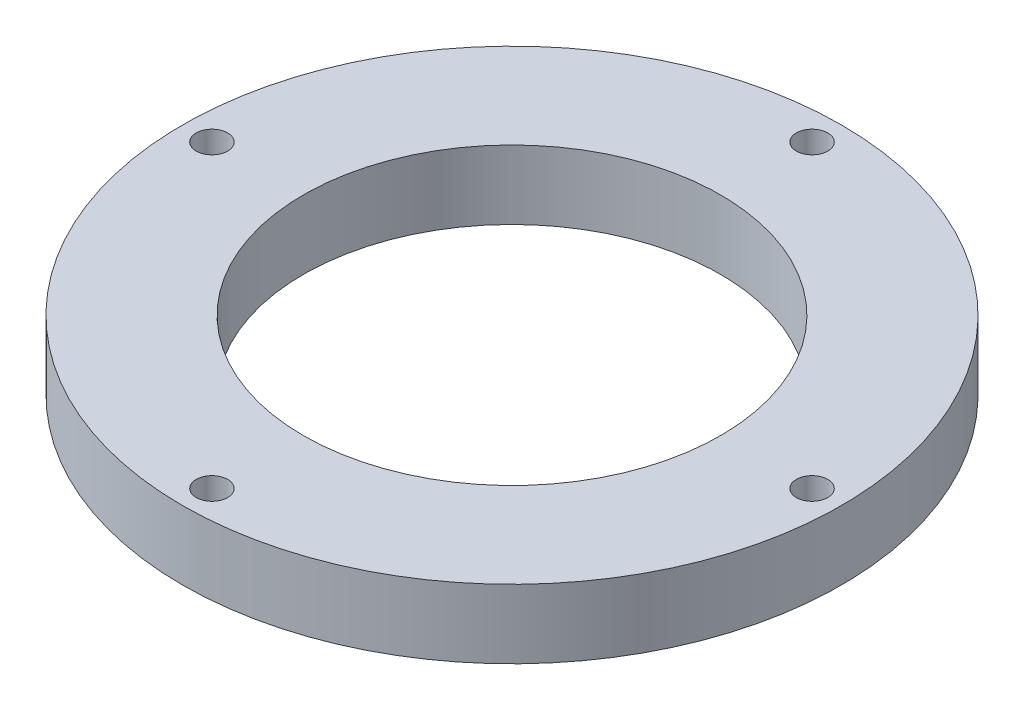
from build123d import *

# Parameters (mm, degrees)
SKETCH1_R           = 33.5
SKETCH1_R_2         = 21.2
BOSS_EXTRUDE1_DEPTH = 7
SKETCH2_R           = 1.6
CUT_EXTRUDE1_DEPTH  = 48.890500102


with BuildPart() as part:
    # Sketch1 → Boss-Extrude1 (new body)
    with BuildSketch(Plane(origin=(0, 0, 0), x_dir=(1, 0, 0), z_dir=(0, 1, 0))):
        with Locations(Location((0, 0, 0), (0, 0, 270))):
            Circle(SKETCH1_R)
        with Locations(Location((0, 0, 0), (0, 0, 270))):
            Circle(SKETCH1_R_2, mode=Mode.SUBTRACT)
    extrude(amount=BOSS_EXTRUDE1_DEPTH)

    # Sketch2 → Cut-Extrude1 (cut, through all)
    with BuildSketch(Plane(origin=(0, 7, 0), x_dir=(1, 0, 0), z_dir=(0, 1, 0))):
        with Locations(Location((0, 30.5, 0), (0, 0, 270))):
            Circle(SKETCH2_R)
        with Locations(Location((30.5, 0, 0), (0, 0, 270))):
            Circle(SKETCH2_R)
        with Locations(Location((0, -30.5, 0), (0, 0, 270))):
            Circle(SKETCH2_R)
        with Locations(Location((-30.5, 0, 0), (0, 0, 270))):
            Circle(SKETCH2_R)
    extrude(amount=-CUT_EXTRUDE1_DEPTH, mode=Mode.SUBTRACT)


solid = part.part
